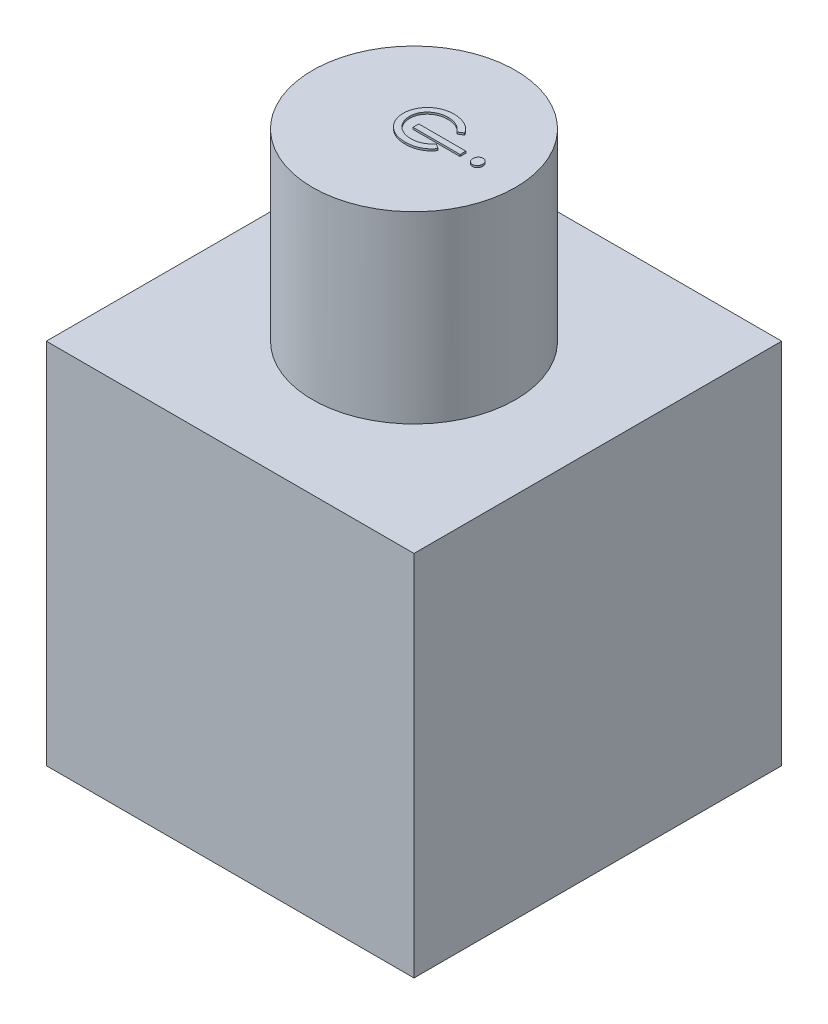
from build123d import *

# Parameters (mm, degrees)
SKETCH1_W           = 20
SKETCH1_H           = 20
BOSS_EXTRUDE1_DEPTH = 20
SKETCH2_R           = 5.520822916
BOSS_EXTRUDE3_DEPTH = 30
BOSS_EXTRUDE4_DEPTH = 0.1
SKETCH4_W           = 2.557692308
SKETCH4_H           = 0.314102564
BOSS_EXTRUDE5_DEPTH = 0.1


with BuildPart() as part:
    # Sketch1 → Boss-Extrude1 (new body)
    with BuildSketch(Plane.XY):
        with Locations((-10, 10)):
            Rectangle(SKETCH1_W, SKETCH1_H)
    extrude(amount=BOSS_EXTRUDE1_DEPTH)

    # Sketch2 → Boss-Extrude3 (add)
    with BuildSketch(Plane(origin=(0, 0, 0), x_dir=(1, 0, 0), z_dir=(0, 1, 0))):
        with Locations((-10, -10)):
            Circle(SKETCH2_R)
    extrude(amount=BOSS_EXTRUDE3_DEPTH)

    # Sketch3 → Boss-Extrude4 (add)
    with BuildSketch(Plane(origin=(0, 30, 0), x_dir=(1, 0, 0), z_dir=(0, 1, 0))):
        with BuildLine():
            Line((-8.325722208, -8.914299791), (-8.588642881, -9.077661169))
            add(Edge.make_bspline(
                [(-8.588642881, -9.077661169), (-8.617472747, -9.041832775), (-8.674219442, -8.971310665), (-8.772758678, -8.880300732), (-8.877770093, -8.80213369), (-8.99104814, -8.738429939), (-9.11243394, -8.689208489), (-9.241448792, -8.654378283), (-9.378074297, -8.63267404), (-9.471739496, -8.630207204), (-9.519732625, -8.628943221)],
                knots=[0, 0, 0, 0, 1.026593902, 2.0206758, 2.988051866, 3.946915611, 4.916868779, 5.907761954, 6.927957743, 8, 8, 8, 8], degree=3))
            add(Edge.make_bspline(
                [(-9.519732625, -8.628943221), (-9.558091582, -8.630000063), (-9.633638505, -8.632081485), (-9.744544658, -8.645091978), (-9.850187011, -8.668733986), (-9.95122772, -8.699884943), (-10.046948139, -8.741635233), (-10.137599057, -8.792444989), (-10.223984547, -8.85149503), (-10.303601288, -8.919905575), (-10.376430295, -8.994304243), (-10.439529209, -9.074057938), (-10.494466143, -9.156777829), (-10.537572099, -9.244529571), (-10.572847269, -9.335305625), (-10.59605399, -9.43081948), (-10.611518685, -9.529847488), (-10.613288014, -9.597365828), (-10.614183747, -9.631547387)],
                knots=[0, 0, 0, 0, 1.112346261, 2.190735716, 3.231507886, 4.247384806, 5.251966152, 6.253067467, 7.256802811, 8.280671706, 9.291813951, 10.270744147, 11.225547591, 12.165006084, 13.100104208, 14.043489273, 15.009504848, 16, 16, 16, 16], degree=3))
            add(Edge.make_bspline(
                [(-10.614183747, -9.631547387), (-10.612404495, -9.676316598), (-10.608869964, -9.765251794), (-10.581168504, -9.896529896), (-10.535824097, -10.023453586), (-10.473766246, -10.145121723), (-10.395289112, -10.257715879), (-10.303116549, -10.358699333), (-10.197197465, -10.446115361), (-10.078465135, -10.518587886), (-9.949707391, -10.576849254), (-9.812317286, -10.618356587), (-9.667417506, -10.643408959), (-9.568210759, -10.646564902), (-9.51762926, -10.64817399)],
                knots=[0, 0, 0, 0, 0.966302908, 1.919585723, 2.883856336, 3.870342332, 4.860282998, 5.839159637, 6.814385684, 7.815993281, 8.834850808, 9.858348828, 10.908058873, 12, 12, 12, 12], degree=3))
            add(Edge.make_bspline(
                [(-9.51762926, -10.64817399), (-9.471274075, -10.646874493), (-9.380173837, -10.644320636), (-9.247006552, -10.622791672), (-9.120226641, -10.587548039), (-8.99983861, -10.538400389), (-8.886062444, -10.474872873), (-8.779633269, -10.396513702), (-8.678433331, -10.305577102), (-8.618936355, -10.23525913), (-8.588642881, -10.199456041)],
                knots=[0, 0, 0, 0, 1.039848629, 2.043578496, 3.018386758, 3.987534228, 4.954977003, 5.934852016, 6.948509513, 8, 8, 8, 8], degree=3))
            Line((-8.588642881, -10.199456041), (-8.325722208, -10.371932003))
            add(Edge.make_bspline(
                [(-8.325722208, -10.371932003), (-8.341309911, -10.39482273), (-8.372433577, -10.440528206), (-8.424461203, -10.504972323), (-8.480581035, -10.565294005), (-8.540574131, -10.621412395), (-8.603657141, -10.674670415), (-8.671985051, -10.722521989), (-8.743354662, -10.767656812), (-8.81860382, -10.808269684), (-8.896954518, -10.844776005), (-8.978296508, -10.876167176), (-9.06227632, -10.903137282), (-9.148992697, -10.924574629), (-9.238616595, -10.941685467), (-9.330916229, -10.953039169), (-9.425859811, -10.96151445), (-9.490031962, -10.962020317), (-9.522537112, -10.962276554)],
                knots=[0, 0, 0, 0, 0.954134338, 1.905101784, 2.851144739, 3.791306361, 4.734911809, 5.6936923, 6.663572882, 7.643865596, 8.638447847, 9.640600242, 10.646758161, 11.676244097, 12.717260333, 13.78922464, 14.880174919, 16, 16, 16, 16], degree=3))
            add(Edge.make_bspline(
                [(-9.522537112, -10.962276554), (-9.572147996, -10.961385274), (-9.669385688, -10.959638359), (-9.811708196, -10.940429884), (-9.947721863, -10.911472268), (-10.077380221, -10.869908534), (-10.200703455, -10.816403758), (-10.317576573, -10.751046844), (-10.427612591, -10.673295054), (-10.529723374, -10.584532285), (-10.62350482, -10.488291644), (-10.704031011, -10.384441726), (-10.773876281, -10.276800678), (-10.829963824, -10.162991152), (-10.874610751, -10.044525779), (-10.905115583, -9.920455539), (-10.924845321, -9.791803285), (-10.927128701, -9.704070403), (-10.928286311, -9.659592259)],
                knots=[0, 0, 0, 0, 1.1129367, 2.181364009, 3.217532258, 4.231199276, 5.232079859, 6.230262199, 7.231623845, 8.250719726, 9.263571943, 10.242672461, 11.195837495, 12.138959767, 13.085126421, 14.0317438, 15.002148558, 16, 16, 16, 16], degree=3))
            add(Edge.make_bspline(
                [(-10.928286311, -9.659592259), (-10.927845295, -9.629413825), (-10.926968041, -9.569383937), (-10.916906113, -9.48028887), (-10.90390764, -9.392380325), (-10.881881903, -9.306772606), (-10.856441271, -9.222167316), (-10.82396574, -9.139584214), (-10.785870345, -9.058639542), (-10.742618397, -8.979541812), (-10.693929652, -8.903592273), (-10.640048419, -8.831838608), (-10.583004083, -8.763418842), (-10.520127971, -8.700695082), (-10.454088317, -8.64115889), (-10.383016741, -8.586400766), (-10.30732089, -8.536259775), (-10.228137567, -8.48980876), (-10.145512856, -8.448449325), (-10.059946185, -8.412816087), (-9.971953156, -8.382363511), (-9.881393012, -8.358254592), (-9.788866839, -8.338037168), (-9.693645501, -8.325319322), (-9.596093279, -8.316333049), (-9.530037256, -8.315342257), (-9.496595606, -8.314840657)],
                knots=[0, 0, 0, 0, 0.990994727, 1.971252077, 2.943264845, 3.907940874, 4.872158414, 5.844625996, 6.82015047, 7.809835459, 8.804511986, 9.781214284, 10.756496977, 11.728388426, 12.696359165, 13.676225489, 14.672885716, 15.677705647, 16.690706858, 17.706033469, 18.721040654, 19.747369689, 20.783475414, 21.830280724, 22.901553713, 24, 24, 24, 24], degree=3))
            add(Edge.make_bspline(
                [(-9.496595606, -8.314840657), (-9.454715498, -8.315762548), (-9.371164618, -8.317601722), (-9.247223911, -8.333080374), (-9.125108718, -8.35641679), (-9.006961614, -8.39098962), (-8.8942151, -8.432853276), (-8.788679649, -8.47986599), (-8.692839546, -8.534460594), (-8.604911956, -8.594180708), (-8.524732439, -8.661541614), (-8.451477947, -8.737348571), (-8.383646297, -8.82120705), (-8.345189586, -8.883012781), (-8.325722208, -8.914299791)],
                knots=[0, 0, 0, 0, 1.095225653, 2.184976855, 3.262915854, 4.344593502, 5.400796181, 6.407717688, 7.363229445, 8.282371371, 9.184954523, 10.097238608, 11.036792983, 12, 12, 12, 12], degree=3))
        make_face()
    extrude(amount=BOSS_EXTRUDE4_DEPTH)

    # Sketch4 → Boss-Extrude5 (add)
    with BuildSketch(Plane(origin=(0, 30, 0), x_dir=(1, 0, 0), z_dir=(0, 1, 0))):
        with BuildLine():
            add(Edge.make_bspline(
                [(-6.365384615, -9.892828526), (-6.36629269, -9.912316587), (-6.368070874, -9.950477954), (-6.383176643, -10.005717448), (-6.409172417, -10.055966244), (-6.442915564, -10.101200835), (-6.484230683, -10.138698232), (-6.53117379, -10.165585861), (-6.58227867, -10.182750842), (-6.617887461, -10.184835854), (-6.636017628, -10.185897436)],
                knots=[0, 0, 0, 0, 1.054986045, 2.065865298, 3.074122704, 4.105114675, 5.109626121, 6.074217918, 7.019490725, 8, 8, 8, 8], degree=3))
            add(Edge.make_bspline(
                [(-6.636017628, -10.185897436), (-6.653677192, -10.184812106), (-6.688588061, -10.182666538), (-6.738806847, -10.16559855), (-6.785096281, -10.138472811), (-6.826330626, -10.101225793), (-6.86005428, -10.055959652), (-6.886055203, -10.005719191), (-6.901159612, -9.950477495), (-6.902937984, -9.912316432), (-6.903846154, -9.892828526)],
                knots=[0, 0, 0, 0, 0.961106377, 1.899993565, 2.859409042, 3.870007927, 4.90724781, 5.921615355, 6.938620636, 8, 8, 8, 8], degree=3))
            add(Edge.make_bspline(
                [(-6.903846154, -9.892828526), (-6.902967151, -9.873564442), (-6.901256287, -9.836069421), (-6.885874492, -9.78184562), (-6.860110821, -9.732405344), (-6.825863936, -9.687910508), (-6.785370463, -9.649925015), (-6.738771881, -9.622899362), (-6.688596963, -9.60578574), (-6.653680183, -9.603646321), (-6.636017628, -9.602564103)],
                knots=[0, 0, 0, 0, 1.055304112, 2.054011575, 3.063363921, 4.096942562, 5.122536081, 6.088009498, 7.032825006, 8, 8, 8, 8], degree=3))
            add(Edge.make_bspline(
                [(-6.636017628, -9.602564103), (-6.617884357, -9.603622457), (-6.582269469, -9.605701133), (-6.531209353, -9.622912645), (-6.483954162, -9.649696813), (-6.443381916, -9.687935052), (-6.409116, -9.732398919), (-6.383357305, -9.781847293), (-6.36797421, -9.836068977), (-6.366263526, -9.873564292), (-6.365384615, -9.892828526)],
                knots=[0, 0, 0, 0, 0.986662878, 1.937868148, 2.908513651, 3.927890639, 4.955204348, 5.958438607, 6.951092507, 8, 8, 8, 8], degree=3))
        make_face()
        with Locations((-8.721153846, -9.894230769)):
            Rectangle(SKETCH4_W, SKETCH4_H)
    extrude(amount=BOSS_EXTRUDE5_DEPTH)


solid = part.part
